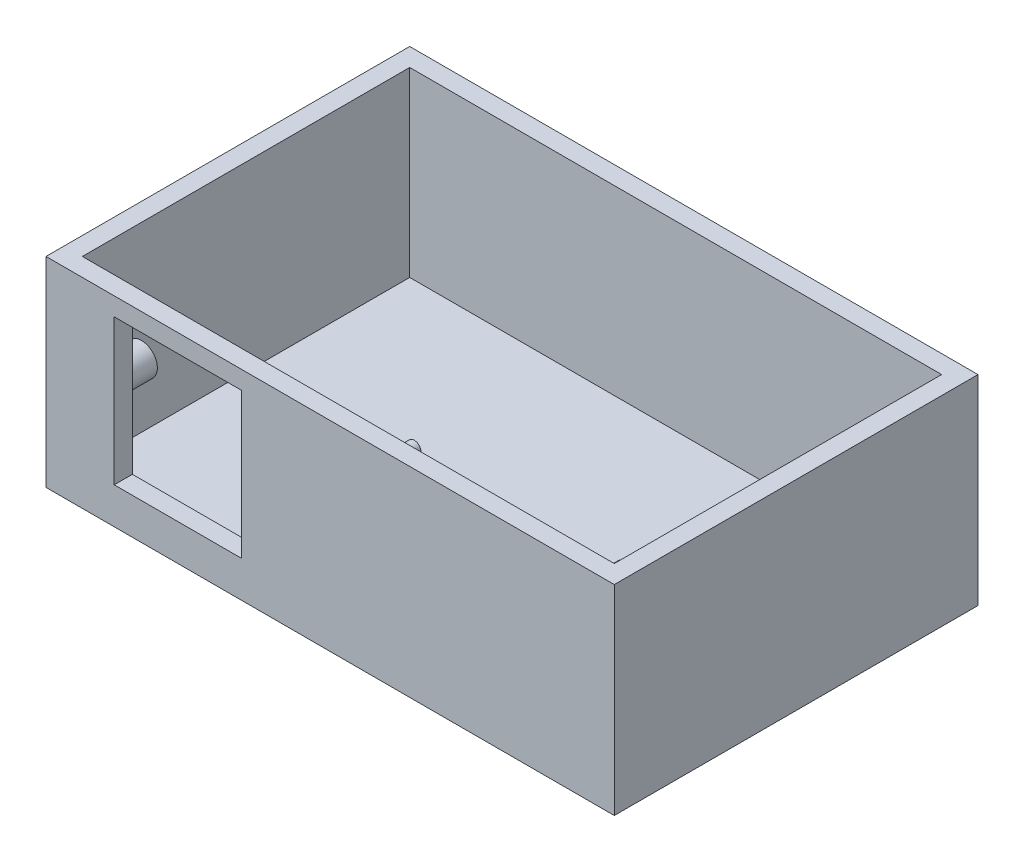
from build123d import *

# Parameters (mm, degrees)
BASE_SKETCH_W                   = 125
BASE_SKETCH_H                   = 80
BASE_EXTRUDE_DEPTH              = 4
WALL_BASE_SKETCH_W              = 125
WALL_BASE_SKETCH_H              = 80
WALL_BASE_SKETCH_W_2            = 117
WALL_BASE_SKETCH_H_2            = 72
WALL_BASE_EXTRUDE_DEPTH         = 40
SPEAKER_HOLE_SKETCH_W           = 28
SPEAKER_HOLE_SKETCH_H           = 32
SPEAKER_HOLE_DEPTH              = 7
SPEAKER_STANDOFFS_SKETCH_R      = 3.5
SPEAKER_STANDOFFS_SKETCH_R_2    = 1.5
SPEAKER_STANDOFFS_EXTRUDE_DEPTH = 7
M1_2X0_25_TAPPED_HOLE2_D        = 0.95
M1_2X0_25_TAPPED_HOLE2_DEPTH    = 3.15
M1_2X0_25_TAPPED_HOLE2_TIP      = 0.285408794


with BuildPart() as part:
    # base sketch → base extrude (new body)
    with BuildSketch(Plane(origin=(0, 0, 0), x_dir=(1, 0, 0), z_dir=(0, 1, 0))):
        with Locations((62.5, 40)):
            Rectangle(BASE_SKETCH_W, BASE_SKETCH_H)
    extrude(amount=BASE_EXTRUDE_DEPTH)

    # wall base sketch → wall base extrude (add)
    with BuildSketch(Plane(origin=(0, 4, 0), x_dir=(1, 0, 0), z_dir=(0, 1, 0))):
        with Locations((62.5, 40)):
            Rectangle(WALL_BASE_SKETCH_W, WALL_BASE_SKETCH_H)
        with Locations((62.5, 40)):
            Rectangle(WALL_BASE_SKETCH_W_2, WALL_BASE_SKETCH_H_2, mode=Mode.SUBTRACT)
    extrude(amount=WALL_BASE_EXTRUDE_DEPTH)

    # speaker hole sketch → speaker hole (cut)
    with BuildSketch(Plane.XY):
        with Locations((29, 24)):
            Rectangle(SPEAKER_HOLE_SKETCH_W, SPEAKER_HOLE_SKETCH_H)
    extrude(amount=-SPEAKER_HOLE_DEPTH, mode=Mode.SUBTRACT)

    # speaker standoffs sketch → speaker standoffs extrude (add)
    with BuildSketch(Plane(origin=(0, 0, -4), x_dir=(-1, 0, 0), z_dir=(0, 0, -1))):
        with Locations((-48, 24)):
            Circle(SPEAKER_STANDOFFS_SKETCH_R)
        with Locations((-10, 24)):
            Circle(SPEAKER_STANDOFFS_SKETCH_R)
        with Locations((-116, 37)):
            Circle(SPEAKER_STANDOFFS_SKETCH_R_2)
        with Locations((-70, 37)):
            Circle(SPEAKER_STANDOFFS_SKETCH_R_2)
        with Locations((-116, 13.5)):
            Circle(SPEAKER_STANDOFFS_SKETCH_R_2)
        with Locations((-70, 14)):
            Circle(SPEAKER_STANDOFFS_SKETCH_R_2)
    extrude(amount=SPEAKER_STANDOFFS_EXTRUDE_DEPTH)

    # M1.2x0.25 Tapped Hole2
    with Locations(Plane(origin=(48, 24, -11), x_dir=(-1, 0, 0), z_dir=(0, 0, -1))):
        with Locations((0, 0), (38, 0), (-22, -10), (-22, 13), (-68, -10.5), (-68, 13)):
            Hole(M1_2X0_25_TAPPED_HOLE2_D / 2, depth=M1_2X0_25_TAPPED_HOLE2_DEPTH)
            with Locations((0, 0, -(M1_2X0_25_TAPPED_HOLE2_DEPTH + M1_2X0_25_TAPPED_HOLE2_TIP / 2))):  # 118° drill point
                Cone(0, M1_2X0_25_TAPPED_HOLE2_D / 2, M1_2X0_25_TAPPED_HOLE2_TIP, mode=Mode.SUBTRACT)


solid = part.part
